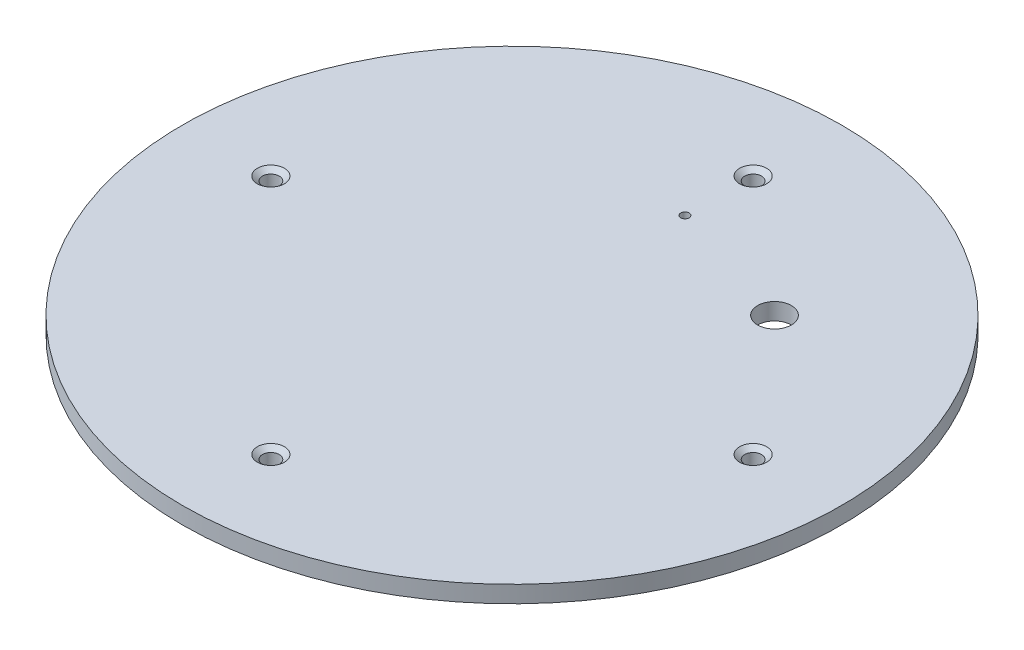
from build123d import *

# Parameters (mm, degrees)
SKETCH1_R                                       = 19.53
BOSS_EXTRUDE1_DEPTH                             = 1
CUT_EXTRUDE1_DEPTH                              = 28.637688036
CUT_EXTRUDE1_DEPTH_BACK                         = 28.637688036
SKETCH6_R                                       = 0.25
SKETCH6_R_2                                     = 1
CSK_FOR_M2_FLAT_HEAD_MACHINE_SCREW1_D           = 1
CSK_FOR_M2_FLAT_HEAD_MACHINE_SCREW1_CSINK_D     = 1.6
CSK_FOR_M2_FLAT_HEAD_MACHINE_SCREW1_CSINK_ANGLE = 100


with BuildPart() as part:
    # Sketch1 → Boss-Extrude1 (new body)
    with BuildSketch(Plane(origin=(0, 0, 0), x_dir=(1, 0, 0), z_dir=(0, 1, 0))):
        with Locations(Location((0, 0, 0), (0, 0, 270))):
            Circle(SKETCH1_R)
    extrude(amount=BOSS_EXTRUDE1_DEPTH)

    # Sketch6 → Cut-Extrude1 (cut, two sides: drawn at the far end of the back side and taken through both)
    with BuildSketch(Plane(origin=(0, 1, 0), x_dir=(1, 0, 0), z_dir=(0, 1, 0)).offset(-CUT_EXTRUDE1_DEPTH_BACK)):
        with Locations(Location((0, 10.25, 0), (0, 0, 270))):
            Circle(SKETCH6_R)
        with Locations(Location((7.778174593, 7.778174593, 0), (0, 0, 270))):
            Circle(SKETCH6_R_2)
    extrude(amount=CUT_EXTRUDE1_DEPTH + CUT_EXTRUDE1_DEPTH_BACK, mode=Mode.SUBTRACT)

    # CSK for M2 Flat Head Machine Screw1 (through all)
    with Locations(Plane(origin=(0, 1, 0), x_dir=(1, 0, 0), z_dir=(0, 1, 0))):
        with Locations((0, 14.29), (-14.29, 0), (0, -14.29), (14.29, 0)):
            CounterSinkHole(CSK_FOR_M2_FLAT_HEAD_MACHINE_SCREW1_D / 2, CSK_FOR_M2_FLAT_HEAD_MACHINE_SCREW1_CSINK_D / 2, counter_sink_angle=CSK_FOR_M2_FLAT_HEAD_MACHINE_SCREW1_CSINK_ANGLE)


solid = part.part
